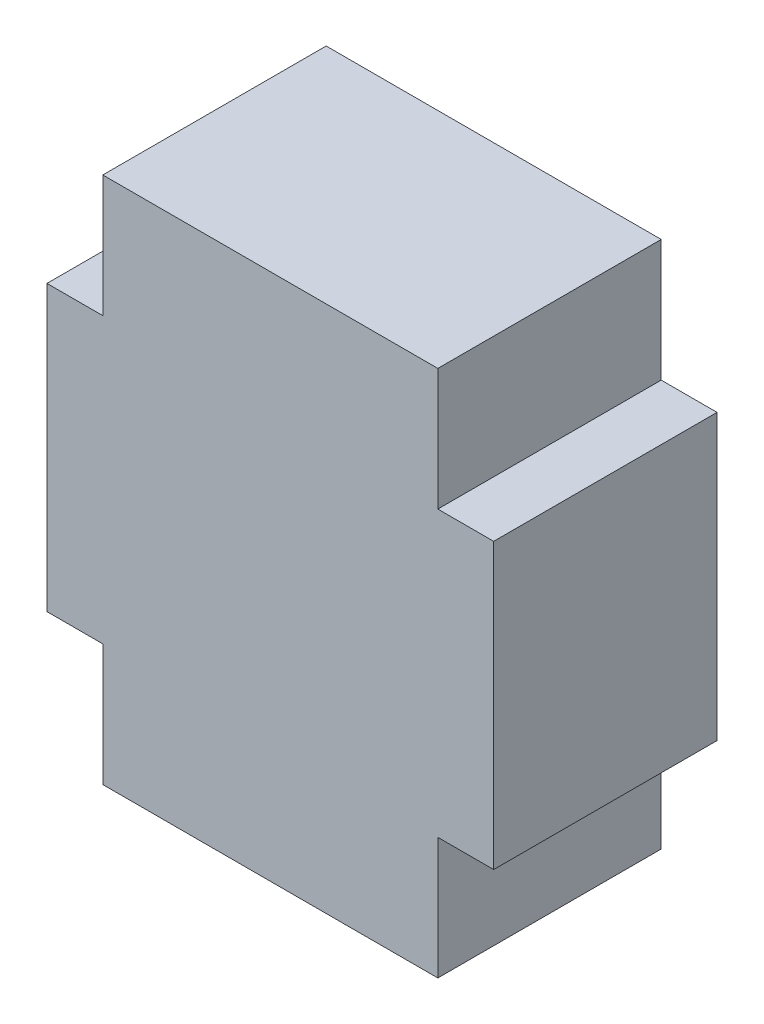
from build123d import *

# Parameters (mm, degrees)
COMPONENT_OUTLINE_DEPTH = 1.1


with BuildPart() as part:
    # 草图1 → Component_Outline (new body)
    with BuildSketch(Plane.XY):
        Polygon((-0.825, -1.3), (-0.825, -0.7), (-1.1, -0.7), (-1.1, 0.7), (-0.825, 0.7), (-0.825, 1.3), (0.825, 1.3), (0.825, 0.7), (1.1, 0.7), (1.1, -0.7), (0.825, -0.7), (0.825, -1.3), align=None)
    extrude(amount=COMPONENT_OUTLINE_DEPTH)


solid = part.part
